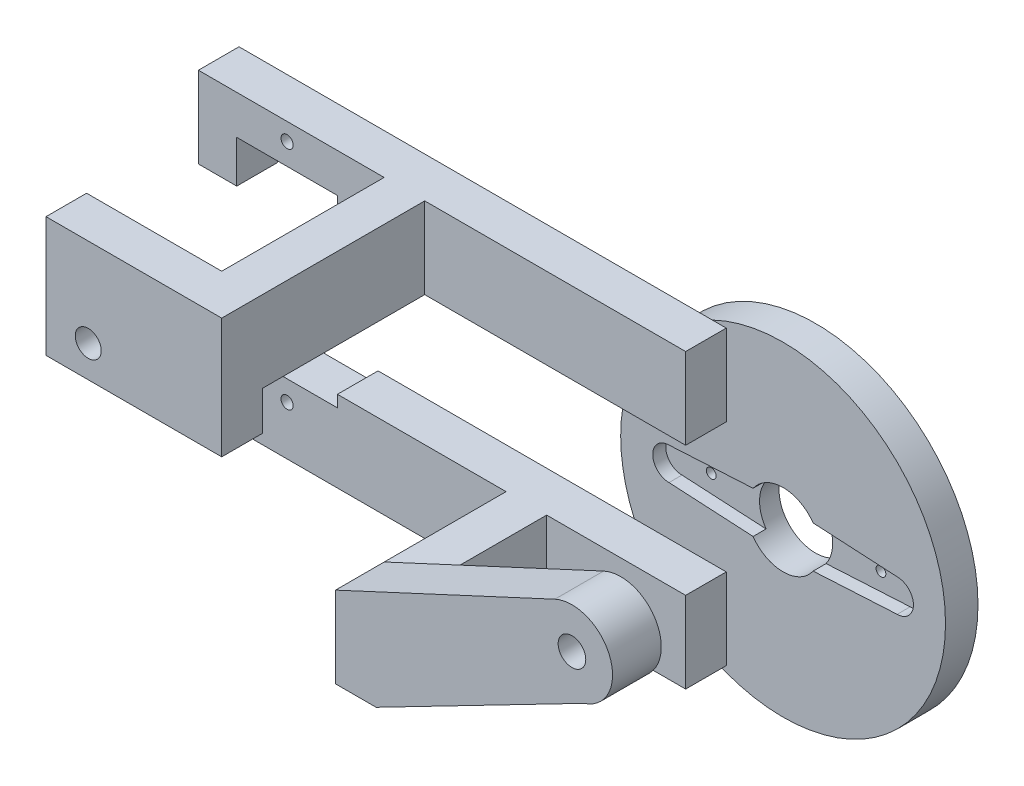
from build123d import *

# Parameters (mm, degrees)
SKETCH1_R            = 20
BOSS_EXTRUDE1_DEPTH  = 4
BOSS_EXTRUDE2_START  = -2.4
BOSS_EXTRUDE2_DEPTH  = 2.4
SKETCH6_W            = 60
SKETCH6_H            = 10
BOSS_EXTRUDE5_DEPTH  = 5
SKETCH7_R            = 0.75
CUT_EXTRUDE1_DEPTH   = 5
SKETCH8_W            = 5
SKETCH8_H            = 10
BOSS_EXTRUDE6_DEPTH  = 20
SKETCH9_W            = 21.637597824
SKETCH9_H            = 14.8
SKETCH9_R            = 1.6
BOSS_EXTRUDE7_DEPTH  = 5
SKETCH10_W           = 12.4
SKETCH10_H           = 22.64948999
CUT_EXTRUDE2_DEPTH   = 75.256312863
SKETCH11_R           = 0.6
CUT_EXTRUDE3_DEPTH   = 10
SKETCH12_R           = 4.5
CUT_EXTRUDE4_DEPTH   = 5
SKETCH14_W           = 5
SKETCH14_H           = 10
BOSS_EXTRUDE9_DEPTH  = 21
SKETCH15_R           = 1.7
BOSS_EXTRUDE10_DEPTH = 6


with BuildPart() as part:
    # Sketch1 → Boss-Extrude1 (new body)
    with BuildSketch(Plane.XY):
        Circle(SKETCH1_R)
        with BuildLine():
            Line((-14.05, 2), (-2.209072203, 2.65))
            ThreePointArc((-2.209072203, 2.65), (0, 3.45), (2.209072203, 2.65))
            Line((2.209072203, 2.65), (14.05, 2))
            ThreePointArc((14.05, 2), (16.05, 0), (14.05, -2))
            Line((14.05, -2), (2.209072203, -2.65))
            ThreePointArc((2.209072203, -2.65), (0, -3.45), (-2.209072203, -2.65))
            Line((-2.209072203, -2.65), (-14.05, -2))
            ThreePointArc((-14.05, -2), (-16.05, 0), (-14.05, 2))
        make_face(mode=Mode.SUBTRACT)
    extrude(amount=-BOSS_EXTRUDE1_DEPTH)

    # Sketch2 → Boss-Extrude2 (add)
    with BuildSketch(Plane(origin=(0, 0, -4), x_dir=(-1, 0, 0), z_dir=(0, 0, -1)).offset(BOSS_EXTRUDE2_START)):
        with BuildLine():
            Line((14.05, 2), (2.209072203, 2.65))
            ThreePointArc((2.209072203, 2.65), (3.45, 0), (2.209072203, -2.65))
            Line((2.209072203, -2.65), (14.05, -2))
            ThreePointArc((14.05, -2), (16.05, 0), (14.05, 2))
        make_face()
        with BuildLine():
            Line((-2.209072203, -2.65), (-14.05, -2))
            ThreePointArc((-14.05, -2), (-16.05, 0), (-14.05, 2))
            Line((-14.05, 2), (-2.209072203, 2.65))
            ThreePointArc((-2.209072203, 2.65), (-3.45, 0), (-2.209072203, -2.65))
        make_face()
    extrude(amount=BOSS_EXTRUDE2_DEPTH)

    # Sketch6 → Boss-Extrude5 (add)
    with BuildSketch(Plane.XY):
        with Locations((-37, 13)):
            Rectangle(SKETCH6_W, SKETCH6_H)
        with Locations((-37, -13)):
            Rectangle(SKETCH6_W, SKETCH6_H)
    extrude(amount=BOSS_EXTRUDE5_DEPTH)

    # Sketch7 → Cut-Extrude1 (cut)
    with BuildSketch(Plane(origin=(0, 0, 0), x_dir=(-1, 0, 0), z_dir=(0, 0, -1))):
        with Locations((56.078339908, 15.85)):
            Circle(SKETCH7_R)
        with Locations((56.078339908, -11.95)):
            Circle(SKETCH7_R)
    extrude(amount=-CUT_EXTRUDE1_DEPTH, mode=Mode.SUBTRACT)

    # Sketch8 → Boss-Extrude6 (add)
    with BuildSketch(Plane.XY.offset(5)):
        with Locations((-41.629269641, 13)):
            Rectangle(SKETCH8_W, SKETCH8_H)
    extrude(amount=BOSS_EXTRUDE6_DEPTH)

    # Sketch9 → Boss-Extrude7 (add)
    with BuildSketch(Plane.XY.offset(25)):
        with Locations((-49.948068553, 10.6)):
            Rectangle(SKETCH9_W, SKETCH9_H)
        with Locations((-55.565935261, 7.090653296)):
            Circle(SKETCH9_R, mode=Mode.SUBTRACT)
    extrude(amount=BOSS_EXTRUDE7_DEPTH)

    # Sketch10 → Cut-Extrude2 (cut, through all)
    with BuildSketch(Plane.XY.offset(5)):
        with Locations((-56.078339908, 1.875255005)):
            Rectangle(SKETCH10_W, SKETCH10_H)
    extrude(amount=-CUT_EXTRUDE2_DEPTH, mode=Mode.SUBTRACT)

    # Sketch11 → Cut-Extrude3 (cut)
    with BuildSketch(Plane.XY):
        with Locations((-10.45, 0)):
            Circle(SKETCH11_R)
        with Locations((10.45, 0)):
            Circle(SKETCH11_R)
    extrude(amount=-CUT_EXTRUDE3_DEPTH, mode=Mode.SUBTRACT)

    # Sketch12 → Cut-Extrude4 (cut)
    with BuildSketch(Plane(origin=(0, 0, -4), x_dir=(-1, 0, 0), z_dir=(0, 0, -1))):
        Circle(SKETCH12_R)
    extrude(amount=-CUT_EXTRUDE4_DEPTH, mode=Mode.SUBTRACT)

    # Sketch14 → Boss-Extrude9 (add)
    with BuildSketch(Plane.XY.offset(5)):
        with Locations((-26.615087819, -13)):
            Rectangle(SKETCH14_W, SKETCH14_H)
    extrude(amount=BOSS_EXTRUDE9_DEPTH)

    # Sketch15 → Boss-Extrude10 (add)
    with BuildSketch(Plane.XY.offset(26)):
        with BuildLine():
            Line((-29.115087819, -8), (-2.104852737, 4.535371535))
            ThreePointArc((-2.104852737, 4.535371535), (4.663893683, 1.802247406), (1.491850027, -4.772251408))
            Line((1.491850027, -4.772251408), (-24.115087819, -18))
            Line((-24.115087819, -18), (-29.115087819, -18))
            Line((-29.115087819, -18), (-29.115087819, -8))
        make_face()
        Circle(SKETCH15_R, mode=Mode.SUBTRACT)
    extrude(amount=-BOSS_EXTRUDE10_DEPTH)


solid = part.part
